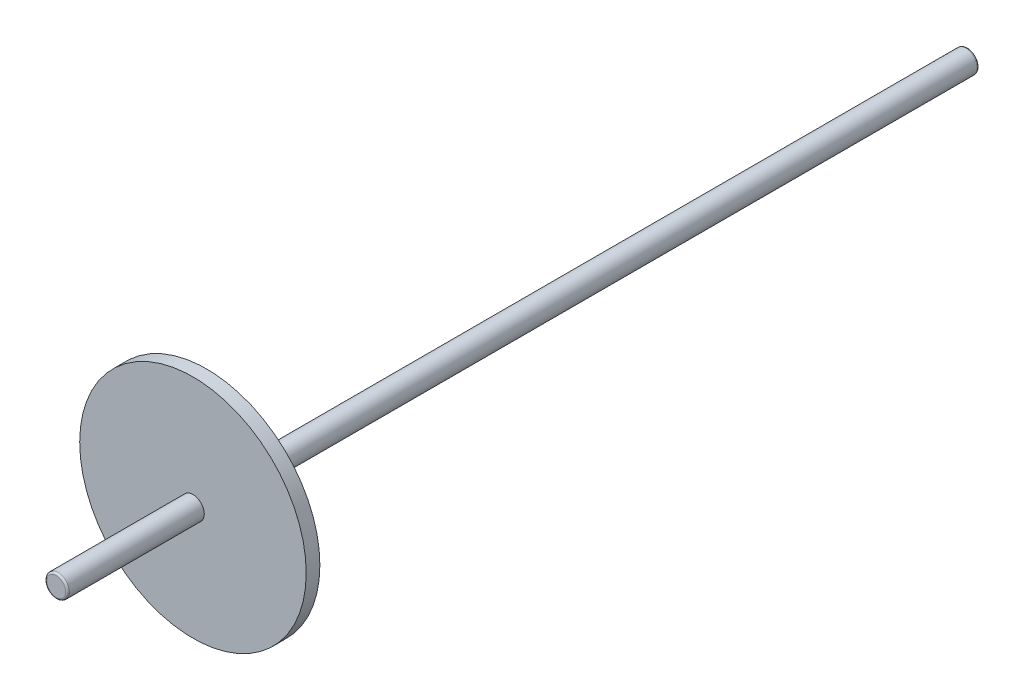
from build123d import *

# Parameters (mm, degrees)
ESBO_O1_R                = 12.425
ESBO_O1_R_2              = 1.2415
RESSALTO_EXTRUS_O1_DEPTH = 1.5
RESSALTO_EXTRUS_O2_START = -1
ESBO_O2_R                = 2.2
ESBO_O2_R_2              = 1.2415
RESSALTO_EXTRUS_O2_DEPTH = 1
RESSALTO_EXTRUS_O3_START = -100
ESBO_O3_R                = 1.2415
RESSALTO_EXTRUS_O3_DEPTH = 100
FILETE1_R                = 0.2


with BuildPart() as part:
    # Esboço1 → Ressalto-extrusão1 (new body)
    with BuildSketch(Plane.XY):
        Circle(ESBO_O1_R)
        Circle(ESBO_O1_R_2, mode=Mode.SUBTRACT)
    extrude(amount=RESSALTO_EXTRUS_O1_DEPTH)

    # Esboço2 → Ressalto-extrusão2 (add)
    with BuildSketch(Plane.XY.offset(RESSALTO_EXTRUS_O2_START)):
        Circle(ESBO_O2_R)
        Circle(ESBO_O2_R_2, mode=Mode.SUBTRACT)
    extrude(amount=RESSALTO_EXTRUS_O2_DEPTH)

    # Esboço3 → Ressalto-extrusão3 (add)
    with BuildSketch(Plane.XY.offset(16.5).offset(RESSALTO_EXTRUS_O3_START)):
        Circle(ESBO_O3_R)
    extrude(amount=RESSALTO_EXTRUS_O3_DEPTH)

    # Filete1
    filete1_edges = [part.edges().sort_by_distance(p)[0] for p in [
        (-1.2415, 0, -83.5),
        (-1.2415, 0, 16.5),
    ]]
    fillet(filete1_edges, radius=FILETE1_R)


solid = part.part
